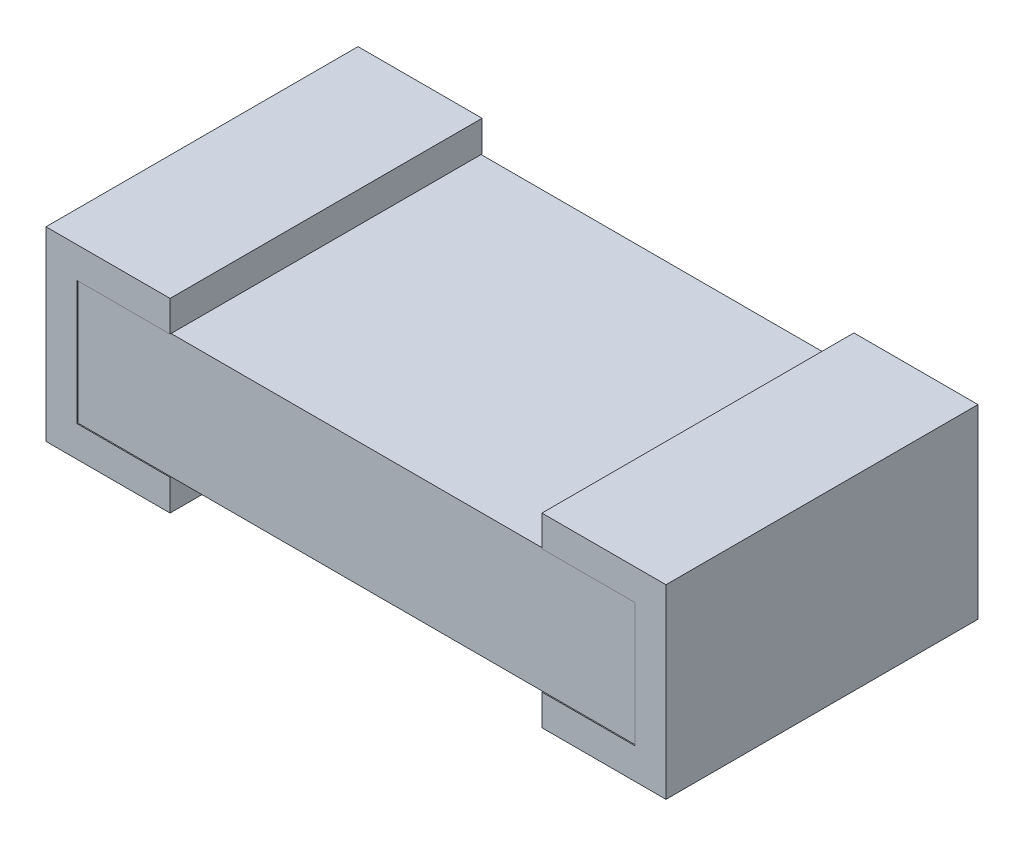
from build123d import *

# Parameters (mm, degrees)
ESBO_O1_W                = 1.372
ESBO_O1_H                = 0.305
RESSALTO_EXTRUS_O1_DEPTH = 0.381
RESSALTO_EXTRUS_O2_DEPTH = 0.3835


with BuildPart() as part:
    # Esboço1 → Ressalto-extrusão1 (new, symmetric)
    with BuildSketch(Plane.XY):
        Rectangle(ESBO_O1_W, ESBO_O1_H)
    extrude(amount=RESSALTO_EXTRUS_O1_DEPTH, both=True)

    # Esboço2 → Ressalto-extrusão2 (add, symmetric)
    with BuildSketch(Plane.XY):
        Polygon((-0.457, 0.1525), (-0.686, 0.1525), (-0.686, -0.1525), (-0.457, -0.1525), (-0.457, -0.2285), (-0.762, -0.2285), (-0.762, 0.2285), (-0.457, 0.2285), align=None)
    ressalto_extrus_o2 = extrude(amount=RESSALTO_EXTRUS_O2_DEPTH, both=True)

    # Espelhar1: Ressalto-extrusão2 across plane
    add(ressalto_extrus_o2.mirror(Plane(origin=(0, 0, 0), x_dir=(0, 0, 1), z_dir=(1, 0, 0))))


solid = part.part
